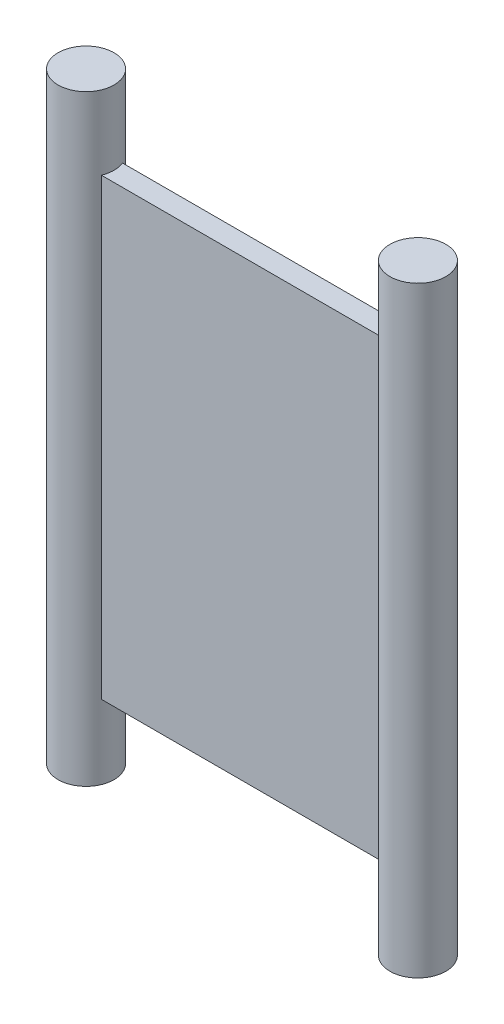
from build123d import *

# Parameters (mm, degrees)
SKETCH1_W           = 15.72
SKETCH1_H           = 1
BOSS_EXTRUDE1_DEPTH = 21.5
SKETCH2_R           = 1.325
BOSS_EXTRUDE2_DEPTH = 14.25


with BuildPart() as part:
    # Sketch1 → Boss-Extrude1 (new body)
    with BuildSketch(Plane(origin=(0, 0, 0), x_dir=(1, 0, 0), z_dir=(0, 1, 0))):
        Rectangle(SKETCH1_W, SKETCH1_H)
    extrude(amount=BOSS_EXTRUDE1_DEPTH)

    # Sketch2 → Boss-Extrude2 (add, symmetric)
    with BuildSketch(Plane(origin=(0, 10.75, 0), x_dir=(1, 0, 0), z_dir=(0, 1, 0))):
        with Locations(Location((-7.86, 0, 0), (0, 0, 270))):
            Circle(SKETCH2_R)
        with Locations(Location((7.86, 0, 0), (0, 0, 270))):
            Circle(SKETCH2_R)
    extrude(amount=BOSS_EXTRUDE2_DEPTH, both=True)


solid = part.part
